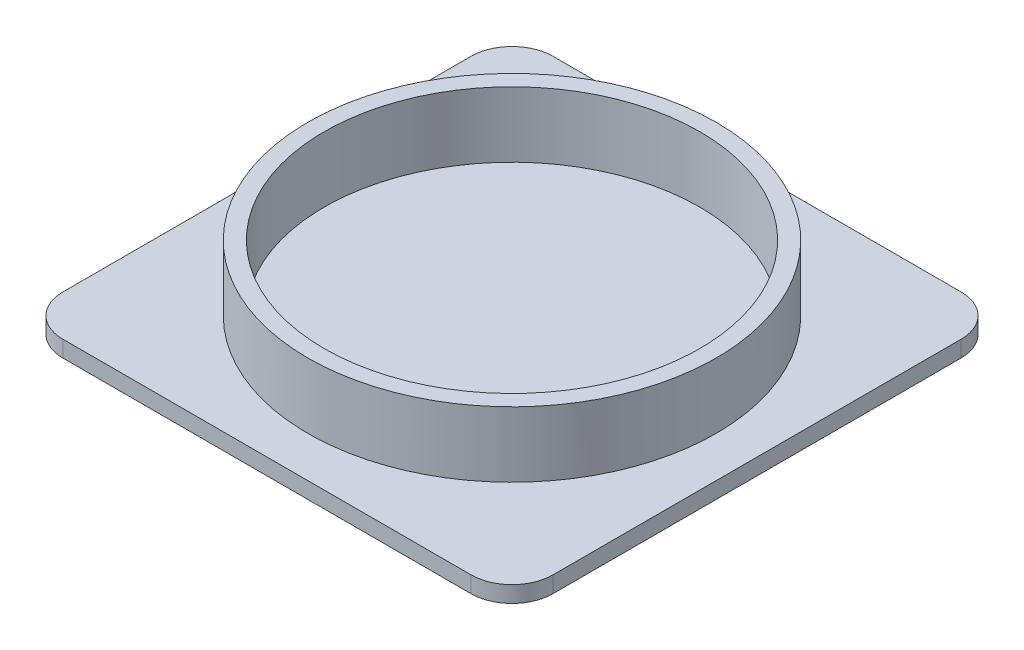
from build123d import *

# Parameters (mm, degrees)
SKETCH1_R           = 31.75
SKETCH1_R_2         = 29.21
BOSS_EXTRUDE1_DEPTH = 12.7
SKETCH2_W           = 76.2
SKETCH2_H           = 76.2
BOSS_EXTRUDE2_DEPTH = 2.54
FILLET1_R           = 6.35


with BuildPart() as part:
    # Sketch1 → Boss-Extrude1 (new body)
    with BuildSketch(Plane(origin=(0, 0, 0), x_dir=(1, 0, 0), z_dir=(0, 1, 0))):
        with Locations(Location((0, 0, 0), (0, 0, 270))):
            Circle(SKETCH1_R)
        with Locations(Location((0, 0, 0), (0, 0, 270))):
            Circle(SKETCH1_R_2, mode=Mode.SUBTRACT)
    extrude(amount=BOSS_EXTRUDE1_DEPTH)

    # Sketch2 → Boss-Extrude2 (add)
    with BuildSketch(Plane(origin=(0, 0, 0), x_dir=(1, 0, 0), z_dir=(0, 1, 0))):
        Rectangle(SKETCH2_W, SKETCH2_H)
    extrude(amount=BOSS_EXTRUDE2_DEPTH)

    # Fillet1
    fillet1_edges = [part.edges().sort_by_distance(p)[0] for p in [
        (38.1, 1.27, 38.1),
        (38.1, 1.27, -38.1),
        (-38.1, 1.27, -38.1),
        (-38.1, 1.27, 38.1),
    ]]
    fillet(fillet1_edges, radius=FILLET1_R)


solid = part.part
